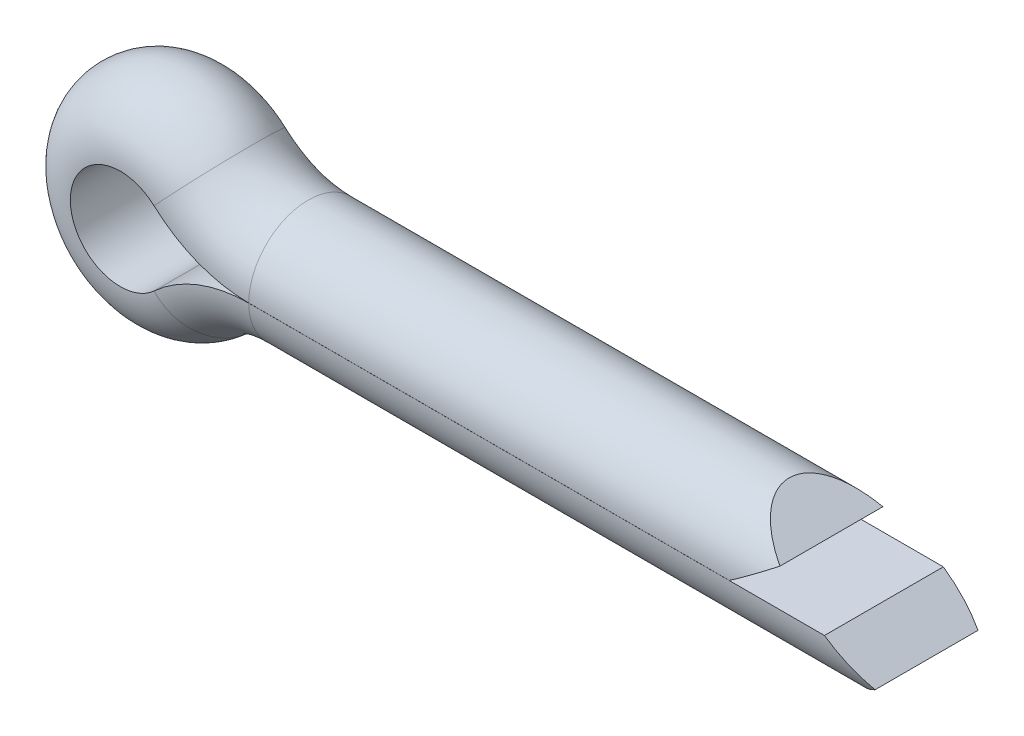
from build123d import *

# Parameters (mm, degrees)
CONECUT_DEPTH      = 27.521877713
CONECUT_DEPTH_BACK = 27.521877713


with BuildPart() as part:
    # Body: sweep along a path in 草图2
    with BuildLine(Plane.XY) as body_path:
        Line((22, 2.5), (0, 2.5))
        ThreePointArc((0, 2.5), (-1.229728386, 2.730698436), (-2.292225201, 3.391420912))
        ThreePointArc((-2.292225201, 3.391420912), (-10, 0), (-2.292225201, -3.391420912))
        ThreePointArc((-2.292225201, -3.391420912), (-1.229728386, -2.730698436), (0, -2.5))
        Line((0, -2.5), (26, -2.5))
    # 草图1 → Body (sweep)
    with BuildSketch(Plane(origin=(22, 0, 0), x_dir=(0, 0, -1), z_dir=(1, 0, 0))):
        with BuildLine():
            Line((-2.4999992, 0.002), (2.4999992, 0.002))
            ThreePointArc((2.4999992, 0.002), (0, 2.5), (-2.4999992, 0.002))
        make_face()
    sweep(path=body_path.line)

    # 草图3 → ConeCut (cut, two sides: drawn at the far end of the back side and taken through both)
    with BuildSketch(Plane.XY.offset(-CONECUT_DEPTH_BACK)):
        Polygon((22, 1.251), (20.210475082, 2.51), (26.01, 2.51), (26.01, -2.51), (24.210475082, -2.51), (26, -1.251), (24.204873421, 0), (20.204873421, 0), align=None)
    extrude(amount=CONECUT_DEPTH + CONECUT_DEPTH_BACK, mode=Mode.SUBTRACT)


solid = part.part
